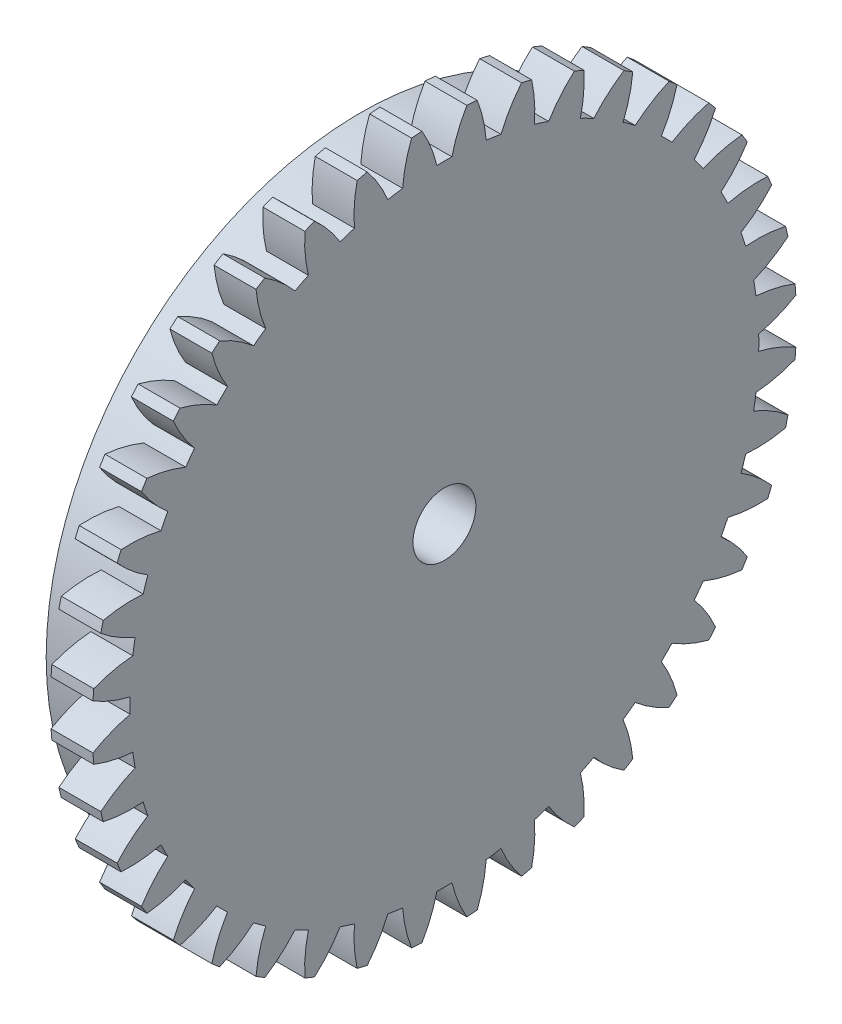
from build123d import *
from build123d.topology import SkipClean

# Parameters (mm, degrees)
BASPROSKE_W      = 2
BASPROSKE_H      = 16.8
TOOTHCUT_DEPTH   = 24.842818625
TEETHCUTS_COUNT  = 40
TEETHCUTS_ANGLE  = 351
HUBNEARONE_START = 2.0000508
HUBNEAONESKE_R   = 14.999
HUBNEARONE_DEPTH = 2.0000508
BORSKE_R         = 1.5
BORE_DEPTH       = 4.0000508


with BuildPart() as part:
    # BasProSke → Base-Revolve (revolve)
    with BuildSketch(Plane(origin=(0, 0, 0), x_dir=(1, 0, 0), z_dir=(0, 1, 0)), mode=Mode.PRIVATE) as base_revolve_sk:
        with Locations((1, 8.4)):
            Rectangle(BASPROSKE_W, BASPROSKE_H)
    revolve(base_revolve_sk.sketch.rotate(Axis((-10, 0, 0), (1, 0, 0)), 180), axis=Axis((-10, 0, 0), (1, 0, 0)))

    # TooCutSke → ToothCut (cut, through all)
    with BuildSketch(Plane(origin=(0, 0, 0), x_dir=(0, 0, -1), z_dir=(1, 0, 0))):
        with BuildLine():
            ThreePointArc((0.358234928, 14.994721362), (0, 14.999), (-0.358234928, 14.994721362))
            ThreePointArc((-0.358234928, 14.994721362), (-0.653764873, 15.920217236), (-1.085976921, 16.790316831))
            ThreePointArc((-1.085976921, 16.790316831), (0, 16.8254), (1.085976921, 16.790316831))
            ThreePointArc((1.085976921, 16.790316831), (0.653764873, 15.920217236), (0.358234928, 14.994721362))
        make_face()
    toothcut = extrude(amount=TOOTHCUT_DEPTH, mode=Mode.SUBTRACT)

    # TeethCuts: ToothCut ×40 about axis
    teethcuts_axis = Axis((-10, 0, 0), (1, 0, 0))
    for i in range(1, TEETHCUTS_COUNT):
        add(toothcut.rotate(teethcuts_axis, i * TEETHCUTS_ANGLE / (TEETHCUTS_COUNT - 1)), mode=Mode.SUBTRACT)

    # HubNeaOneSke → HubNearOne (add)
    with SkipClean():  # the faces are left unmerged after this step: merging them gives an invalid solid
        with BuildSketch(Plane.ZY.offset(HUBNEARONE_START)):
            Circle(HUBNEAONESKE_R)
        extrude(amount=-HUBNEARONE_DEPTH)

    # BorSke → Bore (cut, symmetric)
    with SkipClean():  # the faces are left unmerged after this step: merging them gives an invalid solid
        with BuildSketch(Plane(origin=(0, 0, 0), x_dir=(0, 0, -1), z_dir=(1, 0, 0))):
            with Locations(Location((0, 0, 0), (0, 0, 180))):
                Circle(BORSKE_R)
        extrude(amount=BORE_DEPTH, both=True, mode=Mode.SUBTRACT)


solid = part.part
